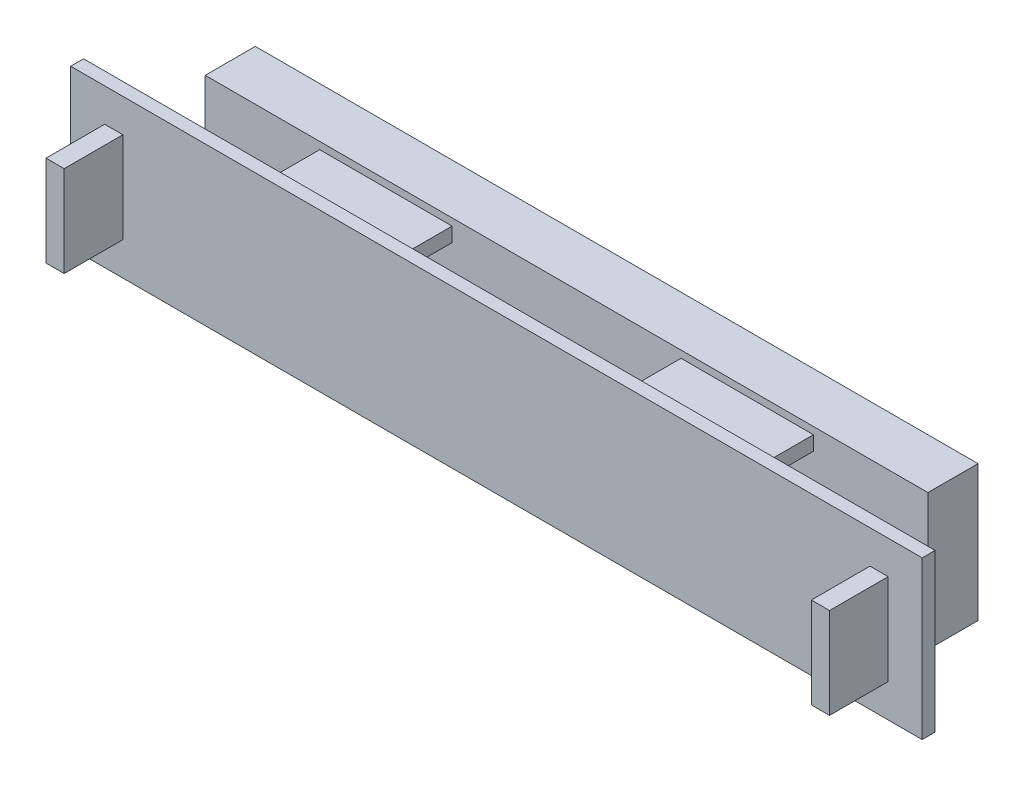
from build123d import *

# Parameters (mm, degrees)
ESQUISSE1_W             = 101
ESQUISSE1_H             = 19
BOSS_EXTRU_1_DEPTH      = 15
ESQUISSE2_W             = 119
ESQUISSE2_H             = 22
BOSS_EXTRU_2_DEPTH      = 1.8
ESQUISSE3_W             = 16
ESQUISSE3_H             = 8
ENL_V_MAT_EXTRU_1_DEPTH = 66.136318594
ESQUISSE4_W             = 8
ESQUISSE4_H             = 1
ESQUISSE4_H_2           = 13
ENL_V_MAT_EXTRU_2_DEPTH = 97.120965455
ESQUISSE5_W             = 28
ESQUISSE5_H             = 10
BOSS_EXTRU_3_DEPTH      = 6
ESQUISSE7_W             = 2.54
ESQUISSE7_H             = 12.7
BOSS_EXTRU_4_DEPTH      = 10


with BuildPart() as part:
    # Esquisse1 → Boss.-Extru.1 (new body)
    with BuildSketch(Plane.XY):
        Rectangle(ESQUISSE1_W, ESQUISSE1_H)
    extrude(amount=BOSS_EXTRU_1_DEPTH)

    # Esquisse2 → Boss.-Extru.2 (add)
    with BuildSketch(Plane.XY.offset(15)):
        Rectangle(ESQUISSE2_W, ESQUISSE2_H)
    extrude(amount=BOSS_EXTRU_2_DEPTH)

    # Esquisse3 → Enlèv. mat.-Extru.1 (cut, through all)
    with BuildSketch(Plane(origin=(0, 9.5, 0), x_dir=(1, 0, 0), z_dir=(0, 1, 0))):
        with Locations((-8, -11)):
            Rectangle(ESQUISSE3_W, ESQUISSE3_H)
        with Locations((8, -11)):
            Rectangle(ESQUISSE3_W, ESQUISSE3_H)
        with Locations((42.5, -11)):
            Rectangle(ESQUISSE3_W, ESQUISSE3_H)
        with Locations((-42.5, -11)):
            Rectangle(ESQUISSE3_W, ESQUISSE3_H)
    extrude(amount=-ENL_V_MAT_EXTRU_1_DEPTH, mode=Mode.SUBTRACT)

    # Esquisse4 → Enlèv. mat.-Extru.2 (cut, through all)
    with BuildSketch(Plane.ZY.offset(34.5)):
        with Locations((11, 9)):
            Rectangle(ESQUISSE4_W, ESQUISSE4_H)
        with Locations((11, 0)):
            Rectangle(ESQUISSE4_W, ESQUISSE4_H_2)
        with Locations((11, -9)):
            Rectangle(ESQUISSE4_W, ESQUISSE4_H)
    extrude(amount=-ENL_V_MAT_EXTRU_2_DEPTH, mode=Mode.SUBTRACT)

    # Esquisse5 → Boss.-Extru.3 (add)
    with BuildSketch(Plane(origin=(0, 0, 15), x_dir=(-1, 0, 0), z_dir=(0, 0, -1))):
        Rectangle(ESQUISSE5_W, ESQUISSE5_H)
    extrude(amount=BOSS_EXTRU_3_DEPTH)

    # Esquisse7 → Boss.-Extru.4 (add)
    with BuildSketch(Plane(origin=(0, 0, 15), x_dir=(-1, 0, 0), z_dir=(0, 0, -1))):
        with Locations((-53.48, 0)):
            Rectangle(ESQUISSE7_W, ESQUISSE7_H)
        with Locations((53.48, 0)):
            Rectangle(ESQUISSE7_W, ESQUISSE7_H)
    extrude(amount=-BOSS_EXTRU_4_DEPTH)


solid = part.part
